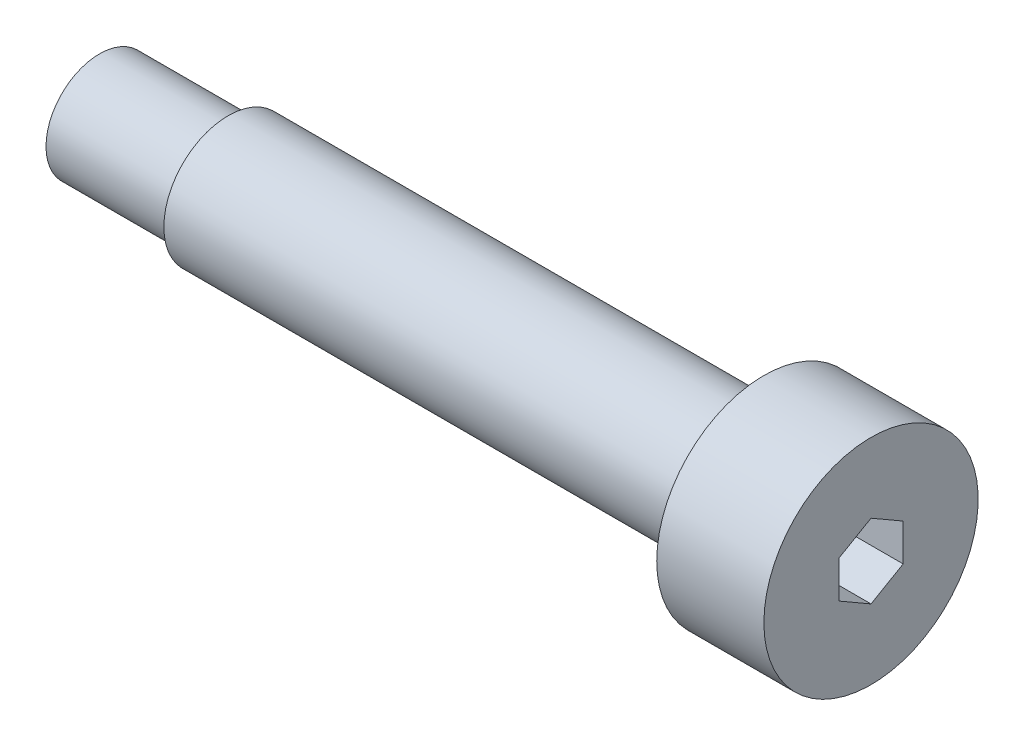
from build123d import *

# Parameters (mm, degrees)
CUT_EXTRUDE1_DEPTH = 3


with BuildPart() as part:
    # Sketch1 → Revolve1 (revolve)
    with BuildSketch(Plane.XY, mode=Mode.PRIVATE) as revolve1_sk:
        Polygon((30, 0), (30, 5), (25, 5), (25, 3), (0, 3), (0, 2.5), (-6, 2.5), (-6, 0), align=None)
    revolve(revolve1_sk.sketch.rotate(Axis((0, 0, 0), (1, 0, 0)), 90), axis=Axis((0, 0, 0), (1, 0, 0)))

    # Sketch2 → Cut-Extrude1 (cut)
    with BuildSketch(Plane(origin=(30, 0, 0), x_dir=(0, 0, -1), z_dir=(1, 0, 0))):
        Polygon((0, 1.732050808), (-1.5, 0.866025404), (-1.5, -0.866025404), (0, -1.732050808), (1.5, -0.866025404), (1.5, 0.866025404), align=None)
    extrude(amount=-CUT_EXTRUDE1_DEPTH, mode=Mode.SUBTRACT)


solid = part.part
